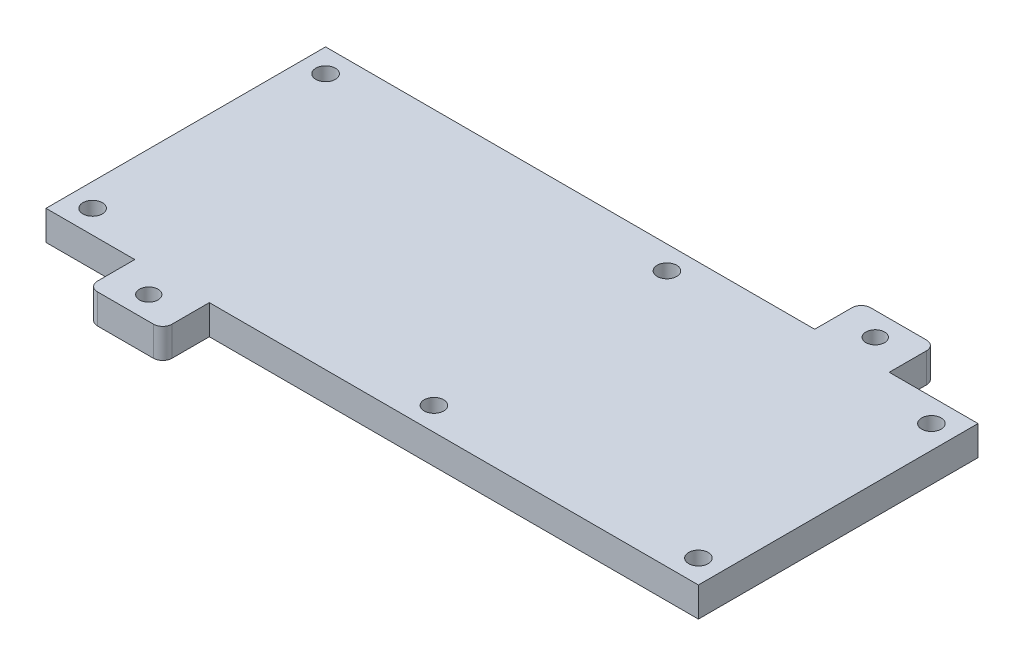
from build123d import *

# Parameters (mm, degrees)
SKETCH1_W           = 140
SKETCH1_H           = 60
SKETCH1_R           = 2.0955
BOSS_EXTRUDE1_DEPTH = 6.35
SKETCH2_W           = 16
SKETCH2_H           = 10
SKETCH2_R           = 2
BOSS_EXTRUDE2_DEPTH = 6.35
FILLET1_R           = 2


with BuildPart() as part:
    # Sketch1 → Boss-Extrude1 (new body)
    with BuildSketch(Plane.XZ):
        with Locations((-8.25, 0)):
            Rectangle(SKETCH1_W, SKETCH1_H)
        with Locations(Location((-73.25, 25, 0), (0, 0, 270))):
            Circle(SKETCH1_R, mode=Mode.SUBTRACT)
        with Locations(Location((0, 25, 0), (0, 0, 270))):
            Circle(SKETCH1_R, mode=Mode.SUBTRACT)
        with Locations(Location((56.75, 25, 0), (0, 0, 270))):
            Circle(SKETCH1_R, mode=Mode.SUBTRACT)
        with Locations(Location((56.75, -25, 0), (0, 0, 270))):
            Circle(SKETCH1_R, mode=Mode.SUBTRACT)
        with Locations(Location((0, -25, 0), (0, 0, 270))):
            Circle(SKETCH1_R, mode=Mode.SUBTRACT)
        with Locations(Location((-73.25, -25, 0), (0, 0, 270))):
            Circle(SKETCH1_R, mode=Mode.SUBTRACT)
    extrude(amount=BOSS_EXTRUDE1_DEPTH)

    # Sketch2 → Boss-Extrude2 (add)
    # profile 1 of 2: a face of its own
    with BuildSketch(Plane.XZ.offset(6.35)):
        with Locations((34.7, -35)):
            Rectangle(SKETCH2_W, SKETCH2_H)
        with Locations(Location((34.7, -35, 0), (0, 0, 270))):
            Circle(SKETCH2_R, mode=Mode.SUBTRACT)
    # profile 2 of 2: a face of its own
    with BuildSketch(Plane.XZ.offset(6.35)):
        with Locations((-51.2, 35)):
            Rectangle(SKETCH2_W, SKETCH2_H)
        with Locations(Location((-51.2, 35, 0), (0, 0, 270))):
            Circle(SKETCH2_R, mode=Mode.SUBTRACT)
    extrude(amount=-BOSS_EXTRUDE2_DEPTH)

    # Fillet1
    fillet1_edges = [part.edges().sort_by_distance(p)[0] for p in [
        (42.7, -3.175, -40),
        (26.7, -3.175, -40),
        (-59.2, -3.175, 40),
        (-43.2, -3.175, 40),
    ]]
    fillet(fillet1_edges, radius=FILLET1_R)


solid = part.part
